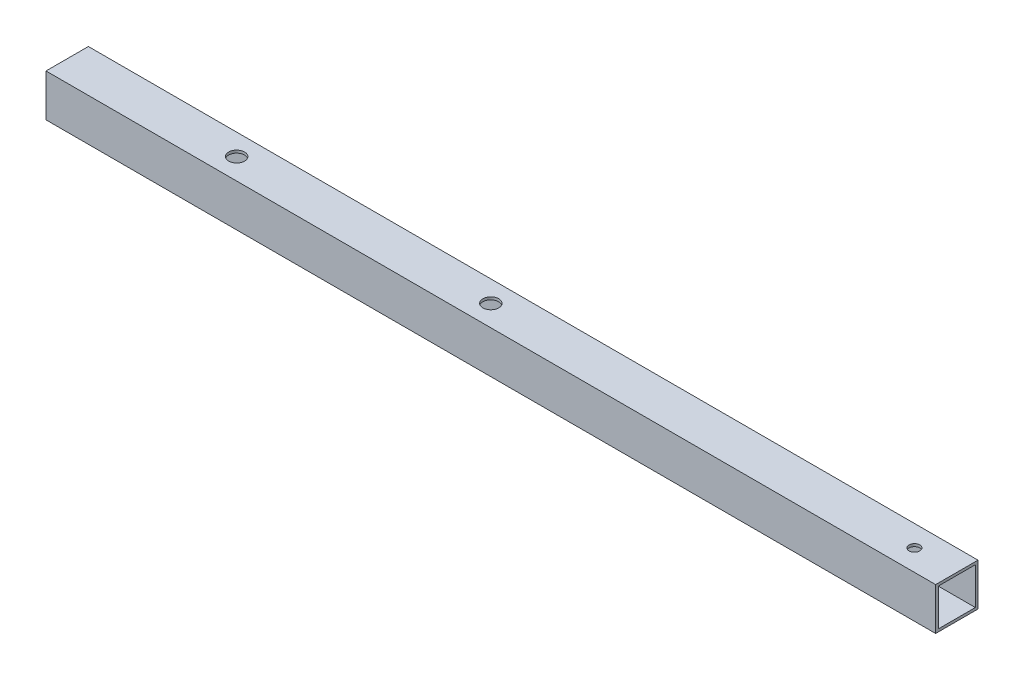
from build123d import *

# Parameters (mm, degrees)
SKETCH1_W           = 25.4
SKETCH1_H           = 25.4
SKETCH1_W_2         = 22.225
SKETCH1_H_2         = 22.225
BOSS_EXTRUDE1_DEPTH = 533.4
SKETCH2_R           = 4.7625
CUT_EXTRUDE1_DEPTH  = 535.155417458
SKETCH3_R           = 3.175
CUT_EXTRUDE2_DEPTH  = 535.155417458


with BuildPart() as part:
    # Sketch1 → Boss-Extrude1 (new body)
    with BuildSketch(Plane(origin=(0, 0, 0), x_dir=(0, 0, -1), z_dir=(1, 0, 0))):
        Rectangle(SKETCH1_W, SKETCH1_H)
        Rectangle(SKETCH1_W_2, SKETCH1_H_2, mode=Mode.SUBTRACT)
    extrude(amount=BOSS_EXTRUDE1_DEPTH)

    # Sketch2 → Cut-Extrude1 (cut, through all)
    with BuildSketch(Plane(origin=(0, 12.7, 0), x_dir=(1, 0, 0), z_dir=(0, 1, 0))):
        with Locations(Location((101.6, 0, 0), (0, 0, 270))):
            Circle(SKETCH2_R)
        with Locations(Location((254, 0, 0), (0, 0, 270))):
            Circle(SKETCH2_R)
    extrude(amount=-CUT_EXTRUDE1_DEPTH, mode=Mode.SUBTRACT)

    # Sketch3 → Cut-Extrude2 (cut, through all)
    with BuildSketch(Plane(origin=(0, 12.7, 0), x_dir=(1, 0, 0), z_dir=(0, 1, 0))):
        with Locations(Location((508, 0, 0), (0, 0, 270))):
            Circle(SKETCH3_R)
    extrude(amount=-CUT_EXTRUDE2_DEPTH, mode=Mode.SUBTRACT)


solid = part.part
